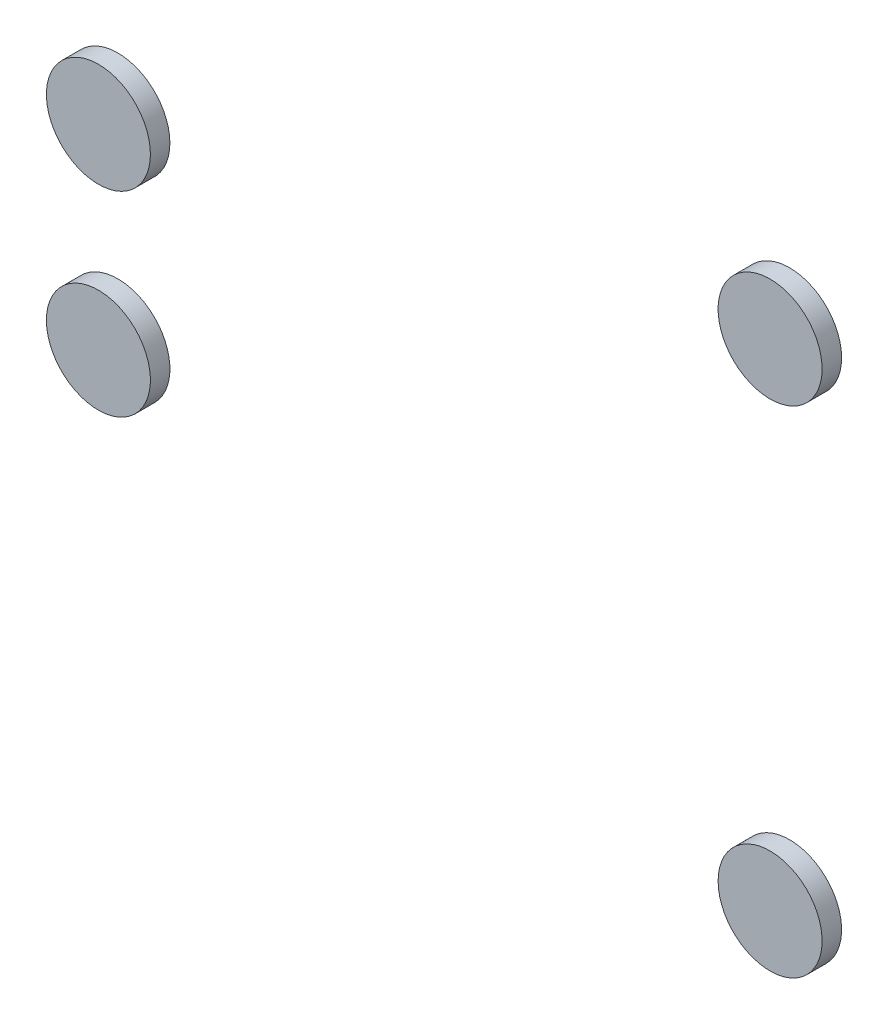
from build123d import *

# Parameters (mm, degrees)
SKETCH_1_R        = 4
EXTRUDE_1_DEPTH   = 1.5
EXTRUDE_1_2_DEPTH = 1.5
EXTRUDE_1_3_DEPTH = 1.5
EXTRUDE_1_4_DEPTH = 1.5


with BuildPart() as part:
    # 草图1 → 凸台-拉伸1 (new body)
    with BuildSketch(Plane.XY):
        with Locations(Location((21, -19.052558883, 0), (0, 0, 180))):
            Circle(SKETCH_1_R)
    extrude(amount=EXTRUDE_1_DEPTH)


with BuildPart() as body_2:
    # 草图1 → Extrude 1 2 (new body)
    with BuildSketch(Plane.XY):
        with Locations(Location((-30.673237657, -7.524443153, 0), (0, 0, 180))):
            Circle(SKETCH_1_R)
    extrude(amount=EXTRUDE_1_2_DEPTH)


with BuildPart() as body_3:
    # 草图1 → Extrude 1 3 (new body)
    with BuildSketch(Plane.XY):
        with Locations((21, 19.052558883)):
            Circle(SKETCH_1_R)
    extrude(amount=EXTRUDE_1_3_DEPTH)


with BuildPart() as body_4:
    # 草图1 → Extrude 1 4 (new body)
    with BuildSketch(Plane.XY):
        with Locations((-30.673237657, 7.524443153)):
            Circle(SKETCH_1_R)
    extrude(amount=EXTRUDE_1_4_DEPTH)


solid = Compound([part.part, body_2.part, body_3.part, body_4.part])
